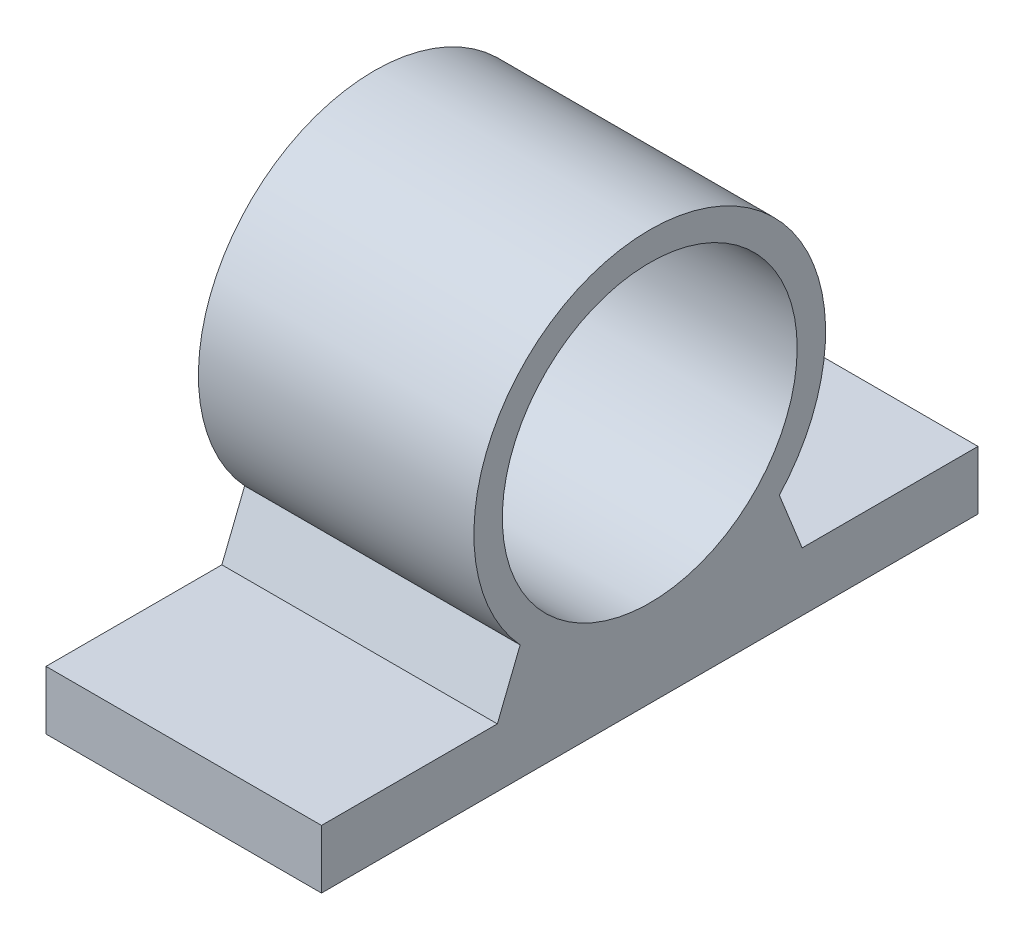
from build123d import *

# Parameters (mm, degrees)
CROQUIS1_R              = 2.5
SALIENTE_EXTRUIR1_DEPTH = 1.25
SALIENTE_EXTRUIR4_DEPTH = 2.5
CROQUIS6_R              = 12.575
CORTAR_EXTRUIR3_DEPTH   = 10
SALIENTE_EXTRUIR5_DEPTH = 200
CROQUIS8_R              = 12.575
SALIENTE_EXTRUIR6_DEPTH = 21
CROQUIS9_W              = 200
CROQUIS9_H              = 30.25
CROQUIS9_H_2            = 5
CROQUIS9_W_2            = 2
CORTAR_EXTRUIR6_DEPTH   = 133.67370689
CROQUIS10_W             = 23.5
CROQUIS10_H             = 5
SALIENTE_EXTRUIR7_DEPTH = 15
CROQUIS11_W             = 23.5
CROQUIS11_H             = 5
SALIENTE_EXTRUIR8_DEPTH = 15


with BuildPart() as part:
    # Croquis1 → Saliente-Extruir1 (new, symmetric)
    with BuildSketch(Plane(origin=(0, 0, 0), x_dir=(0, 0, -1), z_dir=(1, 0, 0))):
        with BuildLine():
            Line((125, -2.5), (-125, -2.5))
            Line((-125, -2.5), (-125, 2.5))
            Line((-125, 2.5), (-123, 2.5))
            Line((-123, 2.5), (-117, 17.5))
            ThreePointArc((-117, 17.5), (-110, 24.5), (-103, 17.5))
            Line((-103, 17.5), (-97, 2.5))
            Line((-97, 2.5), (125, 2.5))
            Line((125, 2.5), (125, -2.5))
        make_face()
        with Locations((-110, 17.5)):
            Circle(CROQUIS1_R, mode=Mode.SUBTRACT)
    extrude(amount=SALIENTE_EXTRUIR1_DEPTH, both=True)

    # Croquis5 → Saliente-Extruir4 (add, through all)
    with BuildSketch(Plane(origin=(1.25, 0, 0), x_dir=(0, 0, -1), z_dir=(1, 0, 0))):
        with BuildLine():
            ThreePointArc((-100, 10), (-110, 5), (-120, 10))
            Line((-120, 10), (-121.0552482, 7.361879501))
            ThreePointArc((-121.0552482, 7.361879501), (-110, 2.5), (-98.9447518, 7.361879501))
            Line((-98.9447518, 7.361879501), (-100, 10))
        make_face()
        with BuildLine():
            Line((-121.0552482, 7.361879501), (-120, 10))
            ThreePointArc((-120, 10), (-113.952847075, 29.358541226), (-97.5, 17.5))
            ThreePointArc((-97.5, 17.5), (-98.141458774, 13.547152925), (-100, 10))
            Line((-100, 10), (-98.9447518, 7.361879501))
            ThreePointArc((-98.9447518, 7.361879501), (-96.020931308, 12.060731804), (-95, 17.5))
            ThreePointArc((-95, 17.5), (-115.439268196, 31.479068692), (-121.0552482, 7.361879501))
        make_face()
    extrude(amount=-SALIENTE_EXTRUIR4_DEPTH)

    # Croquis6 → Cortar-Extruir3 (cut)
    with BuildSketch(Plane(origin=(1.25, 0, 0), x_dir=(0, 0, -1), z_dir=(1, 0, 0))):
        with Locations((-110, 17.5)):
            Circle(CROQUIS6_R)
    extrude(amount=-CORTAR_EXTRUIR3_DEPTH, mode=Mode.SUBTRACT)

    # Croquis7 → Saliente-Extruir5 (add)
    with BuildSketch(Plane(origin=(0, 0, -125), x_dir=(-1, 0, 0), z_dir=(0, 0, -1))):
        Polygon((3.75, 37.75), (3.75, -2.5), (1.25, -2.5), (1.25, 2.5), (1.25, 32.75), (-1.25, 32.75), (-1.25, 37.75), align=None)
    extrude(amount=-SALIENTE_EXTRUIR5_DEPTH)

    # Croquis8 → Saliente-Extruir6 (add)
    with BuildSketch(Plane.ZY.offset(1.25)):
        with BuildLine():
            Line((98.9447518, 7.361879501), (97, 2.5))
            Line((97, 2.5), (95, 2.5))
            Line((95, 2.5), (95, -2.5))
            Line((95, -2.5), (125, -2.5))
            Line((125, -2.5), (125, 2.5))
            Line((125, 2.5), (123, 2.5))
            Line((123, 2.5), (121.0552482, 7.361879501))
            ThreePointArc((121.0552482, 7.361879501), (110, 32.5), (98.9447518, 7.361879501))
        make_face()
        with Locations(Location((110, 17.5, 0), (0, 0, 180))):
            Circle(CROQUIS8_R, mode=Mode.SUBTRACT)
    extrude(amount=SALIENTE_EXTRUIR6_DEPTH)

    # Croquis9 → Cortar-Extruir6 (cut, through all)
    with BuildSketch(Plane(origin=(1.25, 0, 0), x_dir=(0, 0, -1), z_dir=(1, 0, 0))):
        Polygon((-75, 2.5), (-97, 2.5), (-97, -2.5), (125, -2.5), (125, 2.5), align=None)
        with Locations((25, 17.625)):
            Rectangle(CROQUIS9_W, CROQUIS9_H)
        with Locations((25, 35.25)):
            Rectangle(CROQUIS9_W, CROQUIS9_H_2)
        with Locations((-124, 0)):
            Rectangle(CROQUIS9_W_2, CROQUIS9_H_2)
    extrude(amount=-CORTAR_EXTRUIR6_DEPTH, mode=Mode.SUBTRACT)

    # Croquis10 → Saliente-Extruir7 (add)
    with BuildSketch(Plane(origin=(0, 0, 97), x_dir=(-1, 0, 0), z_dir=(0, 0, -1))):
        with Locations((10.5, 0)):
            Rectangle(CROQUIS10_W, CROQUIS10_H)
    extrude(amount=SALIENTE_EXTRUIR7_DEPTH)

    # Croquis11 → Saliente-Extruir8 (add)
    with BuildSketch(Plane.XY.offset(123)):
        with Locations((-10.5, 0)):
            Rectangle(CROQUIS11_W, CROQUIS11_H)
    extrude(amount=SALIENTE_EXTRUIR8_DEPTH)


solid = part.part
